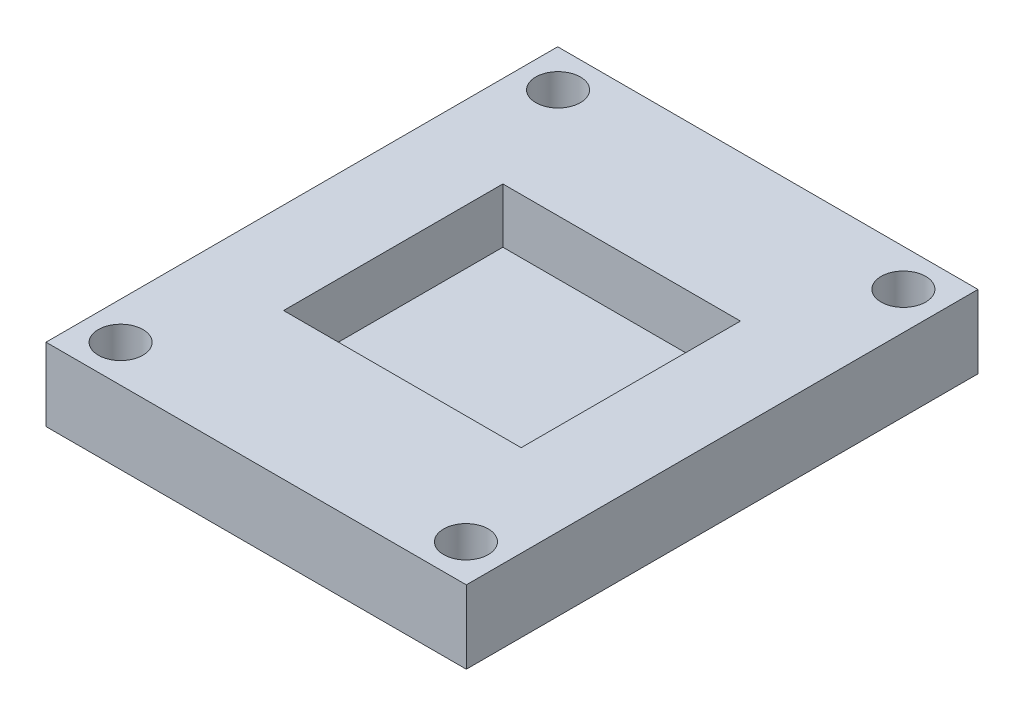
from build123d import *

# Parameters (mm, degrees)
SKETCH1_W           = 29.21
SKETCH1_H           = 35.56
SKETCH1_R           = 1.5499969
BOSS_EXTRUDE1_DEPTH = 5.08
SKETCH2_W           = 16.51
SKETCH2_H           = 15.24
CUT_EXTRUDE1_DEPTH  = 3.81


with BuildPart() as part:
    # Sketch1 → Boss-Extrude1 (new body)
    with BuildSketch(Plane(origin=(0, 0, 0), x_dir=(1, 0, 0), z_dir=(0, 1, 0))):
        with Locations((2.211294118, -3.505162647)):
            Rectangle(SKETCH1_W, SKETCH1_H)
        with Locations(Location((-9.788707282, 11.694832353, 0), (0, 0, 270))):
            Circle(SKETCH1_R, mode=Mode.SUBTRACT)
        with Locations(Location((14.211295518, 11.694832353, 0), (0, 0, 270))):
            Circle(SKETCH1_R, mode=Mode.SUBTRACT)
        with Locations(Location((14.211295518, -18.705157647, 0), (0, 0, 270))):
            Circle(SKETCH1_R, mode=Mode.SUBTRACT)
        with Locations(Location((-9.788707282, -18.705157647, 0), (0, 0, 270))):
            Circle(SKETCH1_R, mode=Mode.SUBTRACT)
    extrude(amount=BOSS_EXTRUDE1_DEPTH)

    # Sketch2 → Cut-Extrude1 (cut)
    with BuildSketch(Plane(origin=(0, 5.08, 0), x_dir=(1, 0, 0), z_dir=(0, 1, 0))):
        with Locations((2.211294118, -3.505162647)):
            Rectangle(SKETCH2_W, SKETCH2_H)
    extrude(amount=-CUT_EXTRUDE1_DEPTH, mode=Mode.SUBTRACT)


solid = part.part
